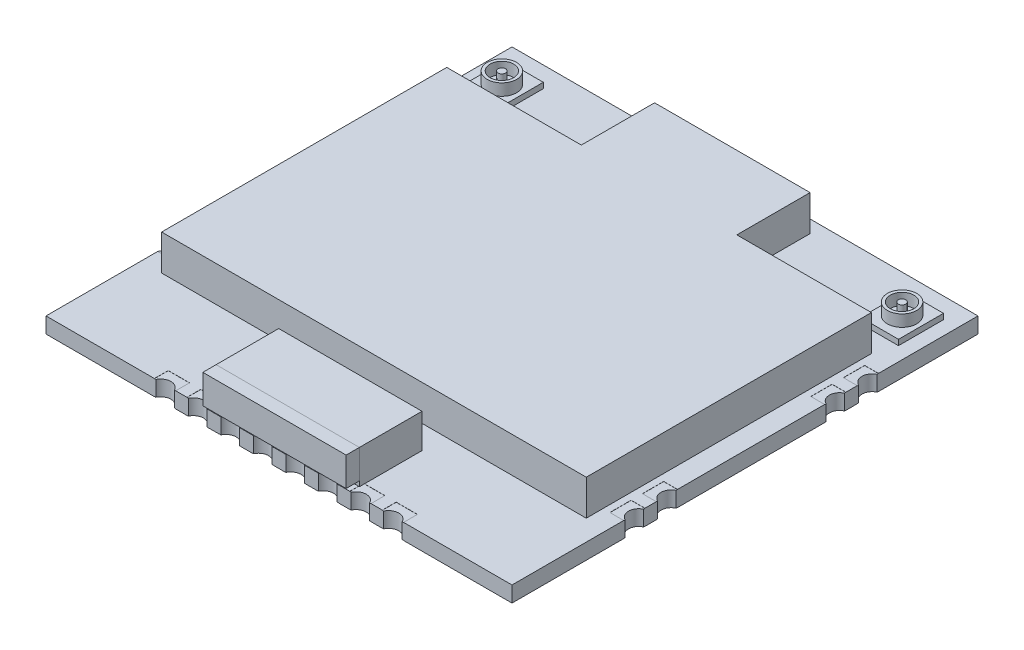
from build123d import *

# Parameters (mm, degrees)
BOSS_EXTRUDE1_DEPTH = 27.432
SCALE1_SCALE        = 0.039370079
BOSS_EXTRUDE2_DEPTH = 2.44
SKETCH3_W           = 2.5
SKETCH3_H           = 1.46
SKETCH3_W_2         = 1.46
SKETCH3_H_2         = 2.5
CUT_EXTRUDE1_DEPTH  = 0.01
CUT_EXTRUDE2_START  = -1.08
SKETCH3_2_W         = 2.5
SKETCH3_2_H         = 1.46
SKETCH3_2_W_2       = 1.46
SKETCH3_2_H_2       = 2.5
CUT_EXTRUDE2_DEPTH  = 0.01
SKETCH4_W           = 2.6
SKETCH4_H           = 3.09
BOSS_EXTRUDE3_DEPTH = 0.38
BOSS_EXTRUDE4_DEPTH = 0.8
SKETCH7_W           = 4.3
SKETCH7_H           = 2.34
BOSS_EXTRUDE5_DEPTH = 4.92
SKETCH8_W           = 0.91
SKETCH8_H           = 1.99
BOSS_EXTRUDE6_DEPTH = 4.92
SKETCH9_W           = 3.871428571
SKETCH9_H           = 3.53
SKETCH9_W_2         = 3.871428572
BOSS_EXTRUDE8_DEPTH = 0.01


with BuildPart() as part:
    # Sketch1 → Boss-Extrude1 (new body)
    with BuildSketch(Plane(origin=(0, 0, 0), x_dir=(1, 0, 0), z_dir=(0, 1, 0))):
        with BuildLine():
            Line((406.4, 406.4), (44.431857143, 406.4))
            ThreePointArc((44.431857143, 406.4), (28.302857143, 396.181585244), (12.173857143, 406.4))
            Line((12.173857143, 406.4), (-12.173857143, 406.4))
            ThreePointArc((-12.173857143, 406.4), (-28.302857143, 396.181585244), (-44.431857143, 406.4))
            Line((-44.431857143, 406.4), (-406.4, 406.4))
            Line((-406.4, 406.4), (-406.4, 230.4034))
            ThreePointArc((-406.4, 230.4034), (-396.181585244, 214.2744), (-406.4, 198.1454))
            Line((-406.4, 198.1454), (-406.4, 173.609))
            ThreePointArc((-406.4, 173.609), (-396.181585244, 157.48), (-406.4, 141.351))
            Line((-406.4, 141.351), (-406.4, -120.1166))
            ThreePointArc((-406.4, -120.1166), (-396.181585244, -136.2456), (-406.4, -152.3746))
            Line((-406.4, -152.3746), (-406.4, -176.911))
            ThreePointArc((-406.4, -176.911), (-396.181585244, -193.04), (-406.4, -209.169))
            Line((-406.4, -209.169), (-406.4, -406.4))
            Line((-406.4, -406.4), (-214.884, -406.4))
            ThreePointArc((-214.884, -406.4), (-198.755, -396.181585244), (-182.626, -406.4))
            Line((-182.626, -406.4), (-158.066619048, -406.4))
            ThreePointArc((-158.066619048, -406.4), (-141.937619048, -396.181585244), (-125.808619048, -406.4))
            Line((-125.808619048, -406.4), (-101.249238095, -406.4))
            ThreePointArc((-101.249238095, -406.4), (-85.120238095, -396.181585244), (-68.991238095, -406.4))
            Line((-68.991238095, -406.4), (-44.431857143, -406.4))
            ThreePointArc((-44.431857143, -406.4), (-28.302857143, -396.181585244), (-12.173857143, -406.4))
            Line((-12.173857143, -406.4), (12.173857143, -406.4))
            ThreePointArc((12.173857143, -406.4), (28.302857143, -396.181585244), (44.431857143, -406.4))
            Line((44.431857143, -406.4), (68.991238095, -406.4))
            ThreePointArc((68.991238095, -406.4), (85.120238095, -396.181585244), (101.249238095, -406.4))
            Line((101.249238095, -406.4), (125.808619048, -406.4))
            ThreePointArc((125.808619048, -406.4), (141.937619048, -396.181585244), (158.066619048, -406.4))
            Line((158.066619048, -406.4), (182.626, -406.4))
            ThreePointArc((182.626, -406.4), (198.755, -396.181585244), (214.884, -406.4))
            Line((214.884, -406.4), (406.4, -406.4))
            Line((406.4, -406.4), (406.4, -209.169))
            ThreePointArc((406.4, -209.169), (396.181585244, -193.04), (406.4, -176.911))
            Line((406.4, -176.911), (406.4, -152.3746))
            ThreePointArc((406.4, -152.3746), (396.181585244, -136.2456), (406.4, -120.1166))
            Line((406.4, -120.1166), (406.4, 141.351))
            ThreePointArc((406.4, 141.351), (396.181585244, 157.48), (406.4, 173.609))
            Line((406.4, 173.609), (406.4, 198.1454))
            ThreePointArc((406.4, 198.1454), (396.181585244, 214.2744), (406.4, 230.4034))
            Line((406.4, 230.4034), (406.4, 406.4))
        make_face()
    extrude(amount=BOSS_EXTRUDE1_DEPTH)


with BuildPart() as part_1:
    # Scale1: scaled about (0, 0, 0)
    add(part.part.scale(SCALE1_SCALE))

    # Sketch3 → Cut-Extrude1 (cut)
    with BuildSketch(Plane(origin=(0, 1.08, 0), x_dir=(1, 0, 0), z_dir=(0, 1, 0))):
        with Locations((-16.3, 8.436)):
            Rectangle(SKETCH3_W, SKETCH3_H)
        with Locations((-16.3, 6.2)):
            Rectangle(SKETCH3_W, SKETCH3_H)
        with Locations((-16.3, -5.364)):
            Rectangle(SKETCH3_W, SKETCH3_H)
        with Locations((-16.3, -7.6)):
            Rectangle(SKETCH3_W, SKETCH3_H)
        with Locations((-7.825, -16.3)):
            Rectangle(SKETCH3_W_2, SKETCH3_H_2)
        with Locations((-5.589285714, -16.3)):
            Rectangle(SKETCH3_W_2, SKETCH3_H_2)
        with Locations((-3.353571429, -16.3)):
            Rectangle(SKETCH3_W_2, SKETCH3_H_2)
        with Locations((-1.117857143, -16.3)):
            Rectangle(SKETCH3_W_2, SKETCH3_H_2)
        with Locations((1.117857143, -16.3)):
            Rectangle(SKETCH3_W_2, SKETCH3_H_2)
        with Locations((3.353571429, -16.3)):
            Rectangle(SKETCH3_W_2, SKETCH3_H_2)
        with Locations((5.589285714, -16.3)):
            Rectangle(SKETCH3_W_2, SKETCH3_H_2)
        with Locations((7.825, -16.3)):
            Rectangle(SKETCH3_W_2, SKETCH3_H_2)
        with Locations((16.3, -7.6)):
            Rectangle(SKETCH3_W, SKETCH3_H)
        with Locations((16.3, -5.364)):
            Rectangle(SKETCH3_W, SKETCH3_H)
        with Locations((16.3, 6.2)):
            Rectangle(SKETCH3_W, SKETCH3_H)
        with Locations((16.3, 8.436)):
            Rectangle(SKETCH3_W, SKETCH3_H)
        with Locations((1.117857143, 16.3)):
            Rectangle(SKETCH3_W_2, SKETCH3_H_2)
        with Locations((-1.117857143, 16.3)):
            Rectangle(SKETCH3_W_2, SKETCH3_H_2)
    extrude(amount=-CUT_EXTRUDE1_DEPTH, mode=Mode.SUBTRACT)

    # Sketch3<2> → Cut-Extrude2 (cut)
    with BuildSketch(Plane(origin=(0, 1.08, 0), x_dir=(1, 0, 0), z_dir=(0, 1, 0)).offset(CUT_EXTRUDE2_START)):
        with Locations((-16.3, 8.436)):
            Rectangle(SKETCH3_2_W, SKETCH3_2_H)
        with Locations((-16.3, 6.2)):
            Rectangle(SKETCH3_2_W, SKETCH3_2_H)
        with Locations((-16.3, -5.364)):
            Rectangle(SKETCH3_2_W, SKETCH3_2_H)
        with Locations((-16.3, -7.6)):
            Rectangle(SKETCH3_2_W, SKETCH3_2_H)
        with Locations((-7.825, -16.3)):
            Rectangle(SKETCH3_2_W_2, SKETCH3_2_H_2)
        with Locations((-5.589285714, -16.3)):
            Rectangle(SKETCH3_2_W_2, SKETCH3_2_H_2)
        with Locations((-3.353571429, -16.3)):
            Rectangle(SKETCH3_2_W_2, SKETCH3_2_H_2)
        with Locations((-1.117857143, -16.3)):
            Rectangle(SKETCH3_2_W_2, SKETCH3_2_H_2)
        with Locations((1.117857143, -16.3)):
            Rectangle(SKETCH3_2_W_2, SKETCH3_2_H_2)
        with Locations((3.353571429, -16.3)):
            Rectangle(SKETCH3_2_W_2, SKETCH3_2_H_2)
        with Locations((5.589285714, -16.3)):
            Rectangle(SKETCH3_2_W_2, SKETCH3_2_H_2)
        with Locations((7.825, -16.3)):
            Rectangle(SKETCH3_2_W_2, SKETCH3_2_H_2)
        with Locations((16.3, -7.6)):
            Rectangle(SKETCH3_2_W, SKETCH3_2_H)
        with Locations((16.3, -5.364)):
            Rectangle(SKETCH3_2_W, SKETCH3_2_H)
        with Locations((16.3, 6.2)):
            Rectangle(SKETCH3_2_W, SKETCH3_2_H)
        with Locations((16.3, 8.436)):
            Rectangle(SKETCH3_2_W, SKETCH3_2_H)
        with Locations((1.117857143, 16.3)):
            Rectangle(SKETCH3_2_W_2, SKETCH3_2_H_2)
        with Locations((-1.117857143, 16.3)):
            Rectangle(SKETCH3_2_W_2, SKETCH3_2_H_2)
    extrude(amount=CUT_EXTRUDE2_DEPTH, mode=Mode.SUBTRACT)


with BuildPart() as body_2:
    # Sketch2 → Boss-Extrude2 (new body)
    with BuildSketch(Plane(origin=(0, 1.08, 0), x_dir=(1, 0, 0), z_dir=(0, 1, 0))):
        Polygon((14.58, -9.48), (-14.58, -9.48), (-14.58, 10.1), (-5.34, 10.1), (-5.34, 15.13), (5.34, 15.13), (5.34, 10.1), (14.58, 10.1), align=None)
    extrude(amount=BOSS_EXTRUDE2_DEPTH)


with BuildPart() as body_3:
    # Sketch4 → Boss-Extrude3 (new body)
    with BuildSketch(Plane(origin=(0, 1.08, 0), x_dir=(1, 0, 0), z_dir=(0, 1, 0))):
        with Locations((-13.74, 13.045)):
            Rectangle(SKETCH4_W, SKETCH4_H)
    extrude(amount=BOSS_EXTRUDE3_DEPTH)


with BuildPart() as body_4:
    # Sketch5 → Boss-Extrude4 (new body)
    with BuildSketch(Plane(origin=(0, 1.46, 0), x_dir=(1, 0, 0), z_dir=(0, 1, 0))):
        with BuildLine():
            ThreePointArc((-12.73, 13.045), (-13.313779208, 13.96066142), (-14.390268982, 13.817819675))
            Line((-14.390268982, 13.817819675), (-14.261502847, 13.664786076))
            ThreePointArc((-14.261502847, 13.664786076), (-13.398179365, 13.779342327), (-12.93, 13.045))
            ThreePointArc((-12.93, 13.045), (-13.005657673, 12.703179365), (-13.218497153, 12.425213924))
            Line((-13.218497153, 12.425213924), (-13.089731018, 12.272180325))
            ThreePointArc((-13.089731018, 12.272180325), (-12.82433858, 12.618779208), (-12.73, 13.045))
        make_face()
        with BuildLine():
            Line((-14.261502847, 13.664786076), (-14.390268982, 13.817819675))
            ThreePointArc((-14.390268982, 13.817819675), (-14.512819675, 12.394731018), (-13.089731018, 12.272180325))
            Line((-13.089731018, 12.272180325), (-13.218497153, 12.425213924))
            ThreePointArc((-13.218497153, 12.425213924), (-14.359786076, 12.523497153), (-14.261502847, 13.664786076))
        make_face()
        with BuildLine():
            ThreePointArc((-13.485, 13.045), (-13.6323898, 13.276181844), (-13.904176822, 13.240117839))
            Line((-13.904176822, 13.240117839), (-13.575823178, 12.849882161))
            ThreePointArc((-13.575823178, 12.849882161), (-13.508818156, 12.9373898), (-13.485, 13.045))
        make_face()
        with BuildLine():
            Line((-13.575823178, 12.849882161), (-13.904176822, 13.240117839))
            ThreePointArc((-13.904176822, 13.240117839), (-13.935117839, 12.880823178), (-13.575823178, 12.849882161))
        make_face()
    extrude(amount=BOSS_EXTRUDE4_DEPTH)


with BuildPart() as body_5:
    # Mirror2: mirrored copy
    add(body_4.part.mirror(Plane(origin=(0, 0, 0), x_dir=(0, 0, 1), z_dir=(1, 0, 0))))


with BuildPart() as body_6:
    # Mirror2 2: mirrored copy
    add(body_3.part.mirror(Plane(origin=(0, 0, 0), x_dir=(0, 0, 1), z_dir=(1, 0, 0))))


with BuildPart() as body_7:
    # Sketch7 → Boss-Extrude5 (new, symmetric)
    with BuildSketch(Plane(origin=(0, 0, 0), x_dir=(0, 0, -1), z_dir=(1, 0, 0))):
        with Locations((-13.25, 2.25)):
            Rectangle(SKETCH7_W, SKETCH7_H)
    extrude(amount=BOSS_EXTRUDE5_DEPTH, both=True)


with BuildPart() as body_8:
    # Sketch8 → Boss-Extrude6 (new, symmetric)
    with BuildSketch(Plane(origin=(0, 0, 0), x_dir=(0, 0, -1), z_dir=(1, 0, 0))):
        with Locations((-15.855, 2.425)):
            Rectangle(SKETCH8_W, SKETCH8_H)
    extrude(amount=BOSS_EXTRUDE6_DEPTH, both=True)


with BuildPart() as body_9:
    # Sketch9 → Boss-Extrude8 (new body)
    with BuildSketch(Plane.XZ):
        with Locations((-11.614285714, 11.525)):
            Rectangle(SKETCH9_W, SKETCH9_H)
        with Locations((-7.742857143, 11.525)):
            Rectangle(SKETCH9_W_2, SKETCH9_H)
        with Locations((-7.742857143, 7.995)):
            Rectangle(SKETCH9_W_2, SKETCH9_H)
        with Locations((-11.614285714, 4.465)):
            Rectangle(SKETCH9_W, SKETCH9_H)
        with Locations((-11.614285714, -6.125)):
            Rectangle(SKETCH9_W, SKETCH9_H)
        with Locations((-11.614285714, -13.185)):
            Rectangle(SKETCH9_W, SKETCH9_H)
        with Locations((-3.871428572, -13.185)):
            Rectangle(SKETCH9_W, SKETCH9_H)
        with Locations((-3.871428572, -6.125)):
            Rectangle(SKETCH9_W, SKETCH9_H)
        with Locations((-7.742857143, -9.655)):
            Rectangle(SKETCH9_W_2, SKETCH9_H)
        with Locations((3.871428572, -6.125)):
            Rectangle(SKETCH9_W, SKETCH9_H)
        with Locations((11.614285714, -6.125)):
            Rectangle(SKETCH9_W, SKETCH9_H)
        with Locations((11.614285714, -13.185)):
            Rectangle(SKETCH9_W, SKETCH9_H)
        with Locations((3.871428572, -13.185)):
            Rectangle(SKETCH9_W, SKETCH9_H)
        with Locations((7.742857143, -9.655)):
            Rectangle(SKETCH9_W_2, SKETCH9_H)
        with Locations((0, -9.655)):
            Rectangle(SKETCH9_W_2, SKETCH9_H)
        with Locations((0, 4.465)):
            Rectangle(SKETCH9_W_2, SKETCH9_H)
        with Locations((-3.871428572, 0.935)):
            Rectangle(SKETCH9_W, SKETCH9_H)
        with Locations((-3.871428572, 7.995)):
            Rectangle(SKETCH9_W, SKETCH9_H)
        with Locations((7.742857143, 11.525)):
            Rectangle(SKETCH9_W_2, SKETCH9_H)
        with Locations((11.614285714, 7.995)):
            Rectangle(SKETCH9_W, SKETCH9_H)
        with Locations((7.742857143, 4.465)):
            Rectangle(SKETCH9_W_2, SKETCH9_H)
        with Locations((11.614285714, 0.935)):
            Rectangle(SKETCH9_W, SKETCH9_H)
        with Locations((11.614285714, -2.595)):
            Rectangle(SKETCH9_W, SKETCH9_H)
        with Locations((0, 11.525)):
            Rectangle(SKETCH9_W_2, SKETCH9_H)
        with Locations((-7.742857143, -2.595)):
            Rectangle(SKETCH9_W_2, SKETCH9_H)
        with Locations((3.871428572, 0.935)):
            Rectangle(SKETCH9_W, SKETCH9_H)
        with Locations((-11.614285714, 0.935)):
            Rectangle(SKETCH9_W, SKETCH9_H)
    extrude(amount=BOSS_EXTRUDE8_DEPTH)


solid = Compound([part_1.part, body_2.part, body_3.part, body_4.part, body_5.part, body_6.part, body_7.part, body_8.part, body_9.part])
